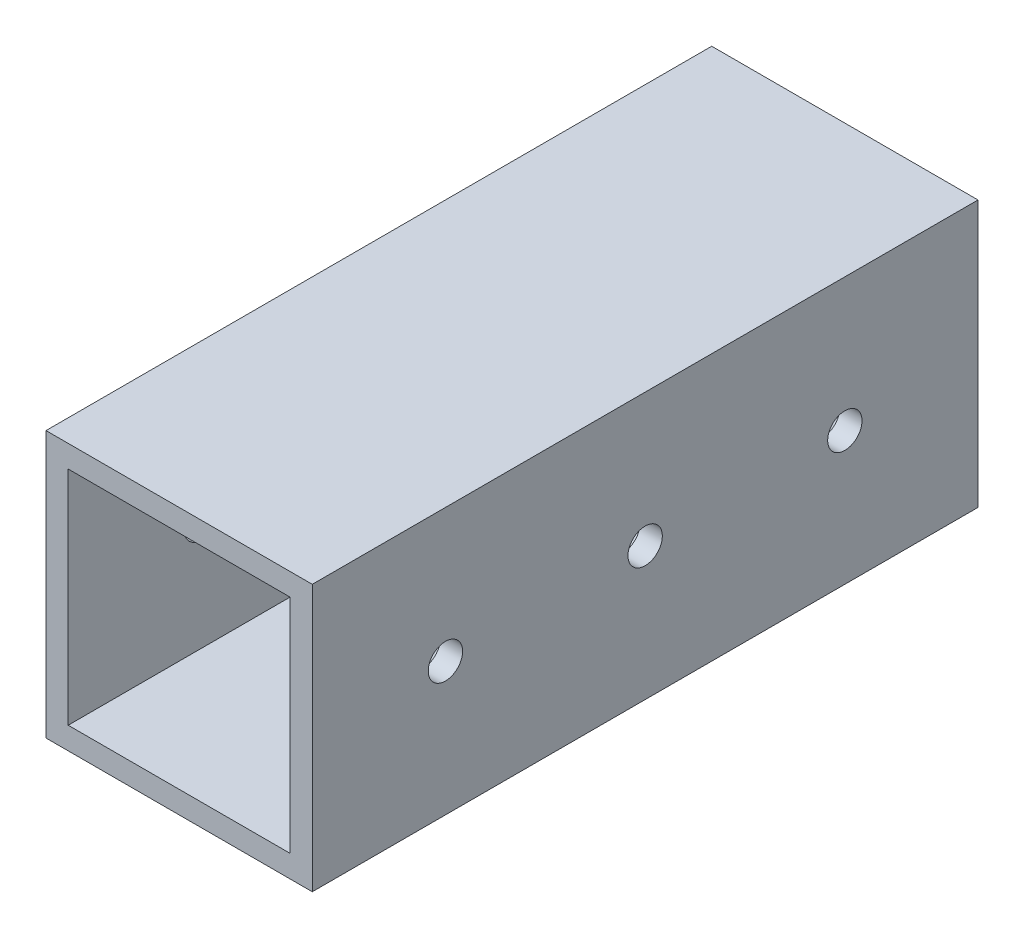
from build123d import *

# Parameters (mm, degrees)
SKETCH1_W                    = 38.1
SKETCH1_H                    = 38.1
SKETCH1_W_2                  = 31.75
SKETCH1_H_2                  = 31.75
BOSS_EXTRUDE1_DEPTH          = 95.25
F_10_0_1935_DIAMETER_HOLE1_D = 4.9149


with BuildPart() as part:
    # Sketch1 → Boss-Extrude1 (new body)
    with BuildSketch(Plane.XY):
        Rectangle(SKETCH1_W, SKETCH1_H)
        Rectangle(SKETCH1_W_2, SKETCH1_H_2, mode=Mode.SUBTRACT)
    extrude(amount=BOSS_EXTRUDE1_DEPTH)

    # #10 (0.1935) Diameter Hole1 (through all)
    with Locations(Plane(origin=(19.05, 0, 19.05), x_dir=(0, 0, 1), z_dir=(1, 0, 0))):
        with Locations((0, 0), (57.15, 0), (28.575, 0)):
            Hole(F_10_0_1935_DIAMETER_HOLE1_D / 2)


solid = part.part
